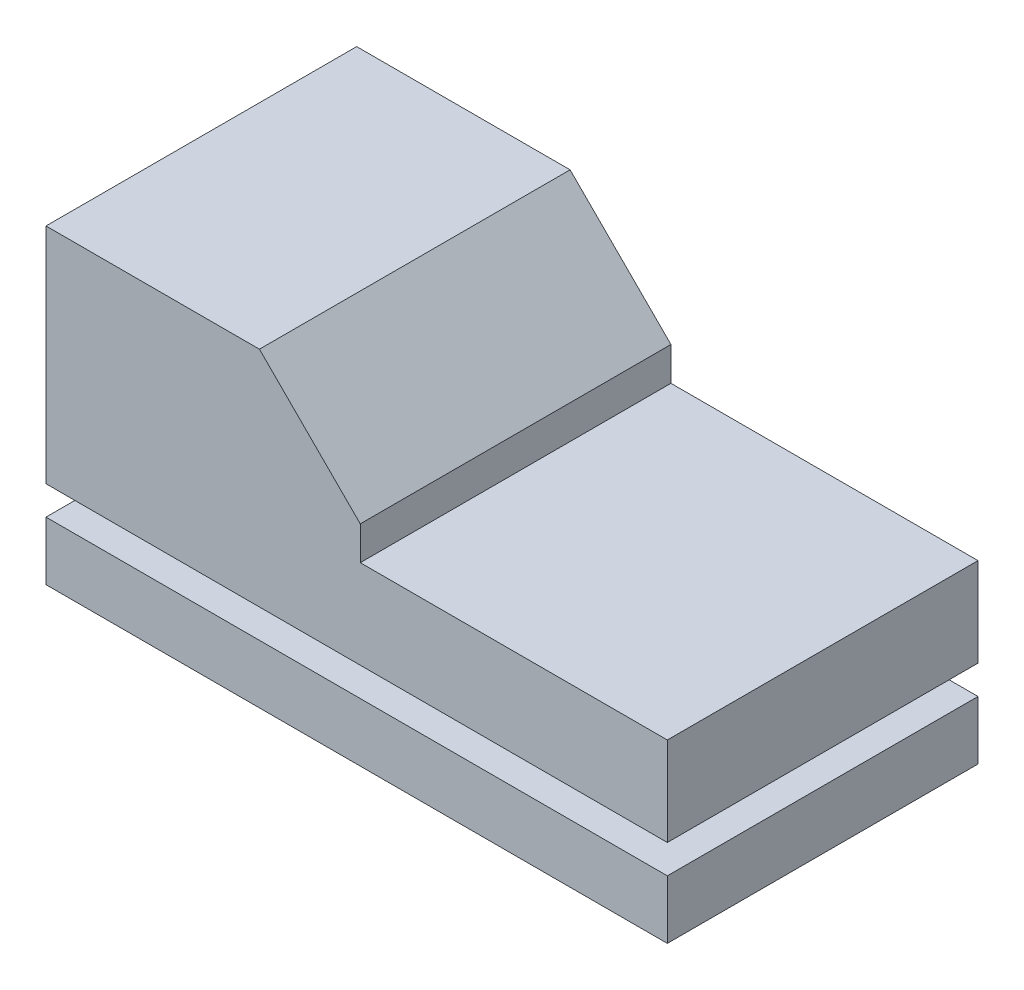
from build123d import *

# Parameters (mm, degrees)
BOSS_EXTRUDE1_DEPTH = 25.4
SKETCH2_W           = 101.6
SKETCH2_H           = 50.8
SKETCH2_W_2         = 90.88
SKETCH2_H_2         = 40.08
CUT_EXTRUDE1_DEPTH  = 4.72
SKETCH3_W           = 82.6
SKETCH3_H           = 30
CUT_EXTRUDE2_DEPTH  = 8.43


with BuildPart() as part:
    # Sketch1 → Boss-Extrude1 (new, symmetric)
    with BuildSketch(Plane.XY):
        Polygon((0, 0), (0, 50.8), (34.9, 50.8), (51.39, 34.31), (51.39, 28.81), (101.6, 28.81), (101.6, 0), align=None)
    extrude(amount=BOSS_EXTRUDE1_DEPTH, both=True)

    # Sketch2 → Cut-Extrude1 (cut)
    with BuildSketch(Plane(origin=(0, 9.57, 0), x_dir=(-1, 0, 0), z_dir=(0, -1, 0))):
        with Locations((-50.8, 0)):
            Rectangle(SKETCH2_W, SKETCH2_H)
        with Locations((-50.8, 0)):
            Rectangle(SKETCH2_W_2, SKETCH2_H_2, mode=Mode.SUBTRACT)
    extrude(amount=-CUT_EXTRUDE1_DEPTH, mode=Mode.SUBTRACT)

    # Sketch3 → Cut-Extrude2 (cut)
    with BuildSketch(Plane.XZ):
        with Locations((50.3, 0)):
            Rectangle(SKETCH3_W, SKETCH3_H)
    extrude(amount=-CUT_EXTRUDE2_DEPTH, mode=Mode.SUBTRACT)


solid = part.part
